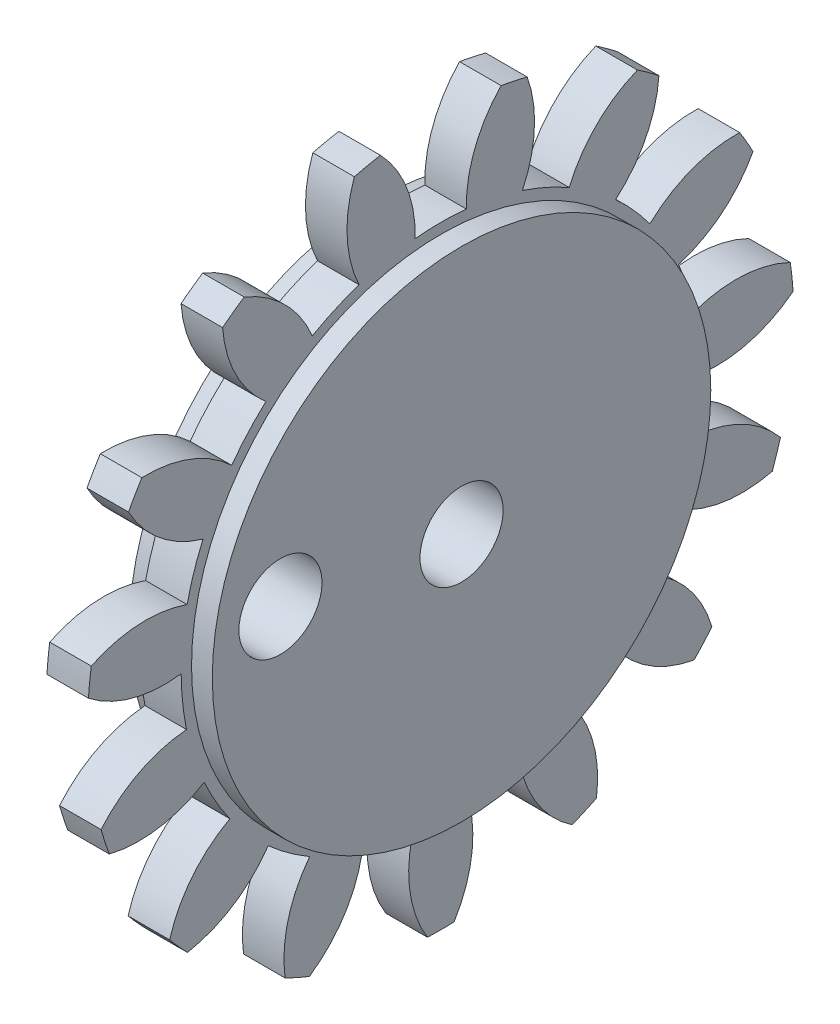
from build123d import *

# Parameters (mm, degrees)
BASPROSKE_W        = 6.35
BASPROSKE_H        = 53.975
TOOTHCUT_DEPTH     = 77.59584682
TEETHCUTS_COUNT    = 15
TEETHCUTS_ANGLE    = 336
HUBNEABOTSKE_R     = 38.1
HUBNEARBOTH_DEPTH  = 3.1750254
HUBFAR_START       = 3.1750254
HUBFARSKE_R        = 38.1
HUBFAR_DEPTH       = 3.1750254
BORSKE_R           = 6.35
BORE_DEPTH         = 12.7000508
SKETCH1_R          = 6.35
CUT_EXTRUDE1_DEPTH = 78.297193623
SCALE1_SCALE       = 0.75


with BuildPart() as part:
    # BasProSke → Base-Revolve (revolve)
    with BuildSketch(Plane(origin=(0, 0, 0), x_dir=(1, 0, 0), z_dir=(0, 1, 0)), mode=Mode.PRIVATE) as base_revolve_sk:
        with Locations((3.175, 26.9875)):
            Rectangle(BASPROSKE_W, BASPROSKE_H)
    revolve(base_revolve_sk.sketch.rotate(Axis((-10, 0, 0), (1, 0, 0)), 180), axis=Axis((-10, 0, 0), (1, 0, 0)))

    # TooCutSke → ToothCut (cut, through all)
    with BuildSketch(Plane(origin=(0, 0, 0), x_dir=(0, 0, -1), z_dir=(1, 0, 0))):
        with BuildLine():
            ThreePointArc((3.91547882, 39.492605349), (0, 39.68623), (-3.91547882, 39.492605349))
            ThreePointArc((-3.91547882, 39.492605349), (-5.201686692, 46.882953453), (-9.241355572, 53.20376441))
            ThreePointArc((-9.241355572, 53.20376441), (0, 54.0004), (9.241355572, 53.20376441))
            ThreePointArc((9.241355572, 53.20376441), (5.201686692, 46.882953453), (3.91547882, 39.492605349))
        make_face()
    toothcut = extrude(amount=TOOTHCUT_DEPTH, mode=Mode.SUBTRACT)

    # TeethCuts: ToothCut ×15 about axis
    teethcuts_axis = Axis((-10, 0, 0), (1, 0, 0))
    for i in range(1, TEETHCUTS_COUNT):
        add(toothcut.rotate(teethcuts_axis, i * TEETHCUTS_ANGLE / (TEETHCUTS_COUNT - 1)), mode=Mode.SUBTRACT)

    # HubNeaBotSke → HubNearBoth (add)
    with BuildSketch(Plane.ZY):
        with Locations(Location((0, 0, 0), (0, 0, 180))):
            Circle(HUBNEABOTSKE_R)
    extrude(amount=HUBNEARBOTH_DEPTH)

    # HubFarSke → HubFar (add)
    with BuildSketch(Plane(origin=(6.35, 0, 0), x_dir=(0, 0, -1), z_dir=(1, 0, 0)).offset(HUBFAR_START)):
        Circle(HUBFARSKE_R)
    extrude(amount=-HUBFAR_DEPTH)

    # BorSke → Bore (cut, symmetric)
    with BuildSketch(Plane(origin=(0, 0, 0), x_dir=(0, 0, -1), z_dir=(1, 0, 0))):
        with Locations(Location((0, 0, 0), (0, 0, 180))):
            Circle(BORSKE_R)
    extrude(amount=BORE_DEPTH, both=True, mode=Mode.SUBTRACT)

    # Sketch1 → Cut-Extrude1 (cut, through all)
    with BuildSketch(Plane.ZY.offset(3.1750254)):
        with Locations((27.682550617, 4.269063845)):
            Circle(SKETCH1_R)
    extrude(amount=-CUT_EXTRUDE1_DEPTH, mode=Mode.SUBTRACT)


with BuildPart() as part_1:
    # Scale1: scaled about (3.175, -0.100027295, -0.648622452)
    add(part.part.scale(SCALE1_SCALE).moved(Location((0.79375, -0.025006824, -0.162155613))))


solid = part_1.part
